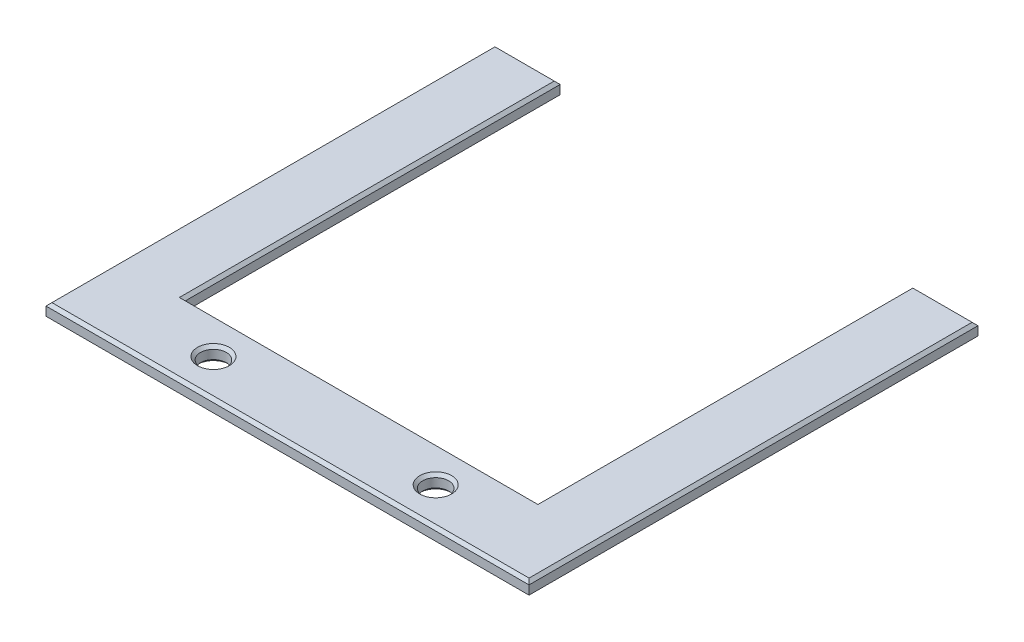
from build123d import *

# Parameters (mm, degrees)
SKETCH1_R           = 1.75
BOSS_EXTRUDE1_DEPTH = 2
CHAMFER1_SIZE       = 0.4


with BuildPart() as part:
    # Sketch1 → Boss-Extrude1 (new body)
    with BuildSketch(Plane(origin=(0, 0, 0), x_dir=(1, 0, 0), z_dir=(0, 1, 0))):
        Polygon((-32.6, 0), (32.6, 0), (32.6, 60.6), (23.8, 60.6), (23.8, 10), (-23.8, 10), (-23.8, 60.6), (-32.6, 60.6), align=None)
        with Locations(Location((-15, 5, 0), (0, 0, 270))):
            Circle(SKETCH1_R, mode=Mode.SUBTRACT)
        with Locations(Location((15, 5, 0), (0, 0, 270))):
            Circle(SKETCH1_R, mode=Mode.SUBTRACT)
    extrude(amount=BOSS_EXTRUDE1_DEPTH)

    # Chamfer1
    chamfer1_edges = [part.edges().sort_by_distance(p)[0] for p in [
        (28.2, 0, -60.6),
        (32.6, 0, -30.3),
        (0, 0, 0),
        (-32.6, 0, -30.3),
        (32.6, 2, -30.3),
        (28.2, 2, -60.6),
        (23.8, 2, -35.3),
        (-15, 0, -6.75),
        (-15, 2, -6.75),
        (0, 2, -10),
        (15, 0, -6.75),
        (15, 2, -6.75),
        (-23.8, 2, -35.3),
        (-28.2, 2, -60.6),
        (-32.6, 2, -30.3),
        (-28.2, 0, -60.6),
        (0, 2, 0),
        (-23.8, 0, -35.3),
        (0, 0, -10),
        (23.8, 0, -35.3),
    ]]
    chamfer(chamfer1_edges, length=CHAMFER1_SIZE)


solid = part.part
